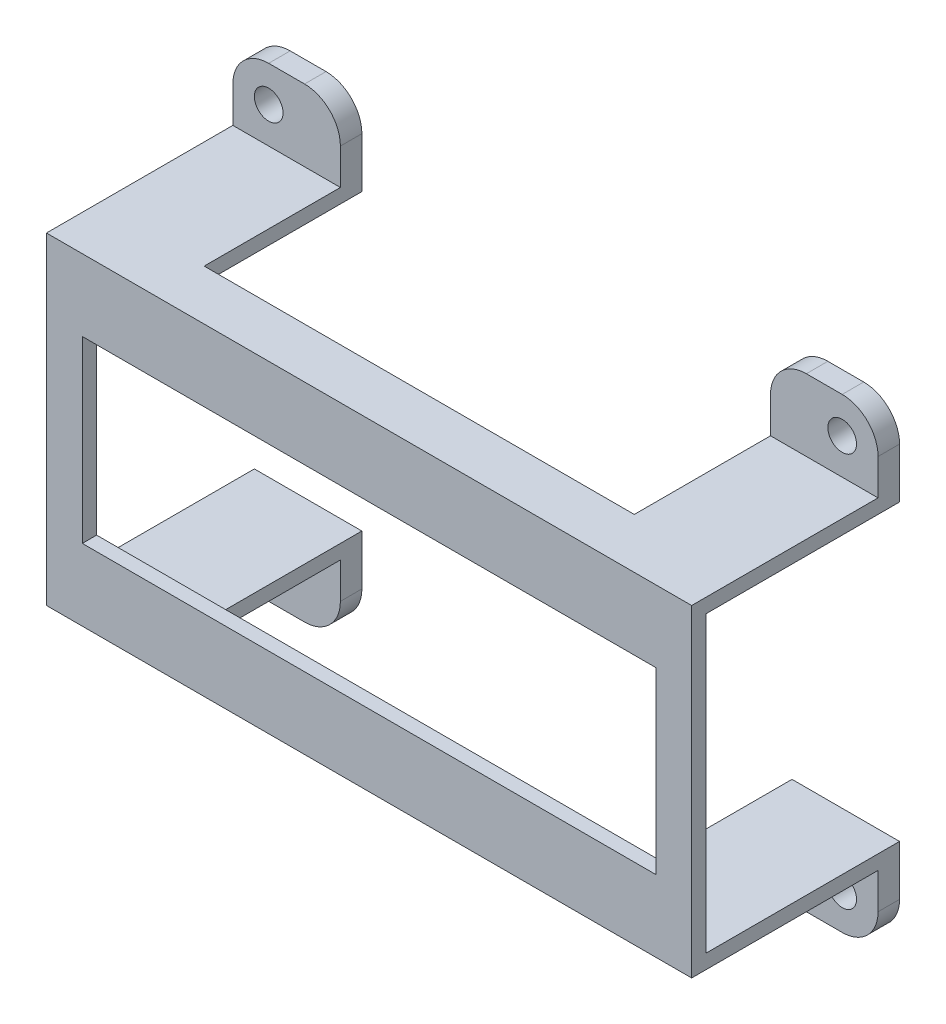
from build123d import *

# Parameters (mm, degrees)
SKETCH1_W           = 90
SKETCH1_H           = 65
BOSS_EXTRUDE1_DEPTH = 3
FILLET4_R           = 5
FILLET5_R           = 5
FILLET6_R           = 5
FILLET7_R           = 5
SKETCH4_W           = 90
SKETCH4_H           = 45
BOSS_EXTRUDE2_DEPTH = 26
SKETCH6_W           = 90
SKETCH6_H           = 41
CUT_EXTRUDE2_DEPTH  = 27
SKETCH5_W           = 80
SKETCH5_H           = 25
CUT_EXTRUDE3_DEPTH  = 3
SKETCH7_R           = 2
CUT_EXTRUDE4_DEPTH  = 3
SKETCH8_R           = 2
CUT_EXTRUDE5_DEPTH  = 3
SKETCH10_W          = 60
SKETCH10_H          = 22
CUT_EXTRUDE7_DEPTH  = 12
FILLET9_R           = 5
FILLET10_R          = 5
SKETCH11_W          = 60
SKETCH11_H          = 22
CUT_EXTRUDE8_DEPTH  = 12
FILLET11_R          = 5
FILLET12_R          = 5


with BuildPart() as part:
    # Sketch1 → Boss-Extrude1 (new body)
    with BuildSketch(Plane.XY):
        Rectangle(SKETCH1_W, SKETCH1_H)
    extrude(amount=BOSS_EXTRUDE1_DEPTH)

    # Fillet4
    fillet4_edges = [part.edges().sort_by_distance(p)[0] for p in [
        (-45, -32.5, 1.5),
    ]]
    fillet(fillet4_edges, radius=FILLET4_R)

    # Fillet5
    fillet5_edges = [part.edges().sort_by_distance(p)[0] for p in [
        (45, -32.5, 1.5),
    ]]
    fillet(fillet5_edges, radius=FILLET5_R)

    # Fillet6
    fillet6_edges = [part.edges().sort_by_distance(p)[0] for p in [
        (45, 32.5, 1.5),
    ]]
    fillet(fillet6_edges, radius=FILLET6_R)

    # Fillet7
    fillet7_edges = [part.edges().sort_by_distance(p)[0] for p in [
        (-45, 32.5, 1.5),
    ]]
    fillet(fillet7_edges, radius=FILLET7_R)

    # Sketch4 → Boss-Extrude2 (add)
    with BuildSketch(Plane.XY.offset(3)):
        Rectangle(SKETCH4_W, SKETCH4_H)
    extrude(amount=BOSS_EXTRUDE2_DEPTH)

    # Sketch6 → Cut-Extrude2 (cut)
    with BuildSketch(Plane(origin=(0, 0, 0), x_dir=(-1, 0, 0), z_dir=(0, 0, -1))):
        Rectangle(SKETCH6_W, SKETCH6_H)
    extrude(amount=-CUT_EXTRUDE2_DEPTH, mode=Mode.SUBTRACT)

    # Sketch5 → Cut-Extrude3 (cut)
    with BuildSketch(Plane.XY.offset(29)):
        Rectangle(SKETCH5_W, SKETCH5_H)
    extrude(amount=-CUT_EXTRUDE3_DEPTH, mode=Mode.SUBTRACT)

    # Sketch7 → Cut-Extrude4 (cut)
    with BuildSketch(Plane.XY.offset(3)):
        with Locations((40, -27.5)):
            Circle(SKETCH7_R)
        with Locations((-40, -27.5)):
            Circle(SKETCH7_R)
    extrude(amount=-CUT_EXTRUDE4_DEPTH, mode=Mode.SUBTRACT)

    # Sketch8 → Cut-Extrude5 (cut)
    with BuildSketch(Plane.XY.offset(3)):
        with Locations((-40, 27.5)):
            Circle(SKETCH8_R)
        with Locations((40, 27.5)):
            Circle(SKETCH8_R)
    extrude(amount=-CUT_EXTRUDE5_DEPTH, mode=Mode.SUBTRACT)

    # Sketch10 → Cut-Extrude7 (cut)
    with BuildSketch(Plane.XZ.offset(-20.5)):
        with Locations((0, 11)):
            Rectangle(SKETCH10_W, SKETCH10_H)
    extrude(amount=-CUT_EXTRUDE7_DEPTH, mode=Mode.SUBTRACT)

    # Fillet9
    fillet9_edges = [part.edges().sort_by_distance(p)[0] for p in [
        (-30, 32.5, 1.5),
    ]]
    fillet(fillet9_edges, radius=FILLET9_R)

    # Fillet10
    fillet10_edges = [part.edges().sort_by_distance(p)[0] for p in [
        (30, 32.5, 1.5),
    ]]
    fillet(fillet10_edges, radius=FILLET10_R)

    # Sketch11 → Cut-Extrude8 (cut)
    with BuildSketch(Plane(origin=(0, -20.5, 0), x_dir=(1, 0, 0), z_dir=(0, 1, 0))):
        with Locations((0, -11)):
            Rectangle(SKETCH11_W, SKETCH11_H)
    extrude(amount=-CUT_EXTRUDE8_DEPTH, mode=Mode.SUBTRACT)

    # Fillet11
    fillet11_edges = [part.edges().sort_by_distance(p)[0] for p in [
        (30, -32.5, 1.5),
    ]]
    fillet(fillet11_edges, radius=FILLET11_R)

    # Fillet12
    fillet12_edges = [part.edges().sort_by_distance(p)[0] for p in [
        (-30, -32.5, 1.5),
    ]]
    fillet(fillet12_edges, radius=FILLET12_R)


solid = part.part
